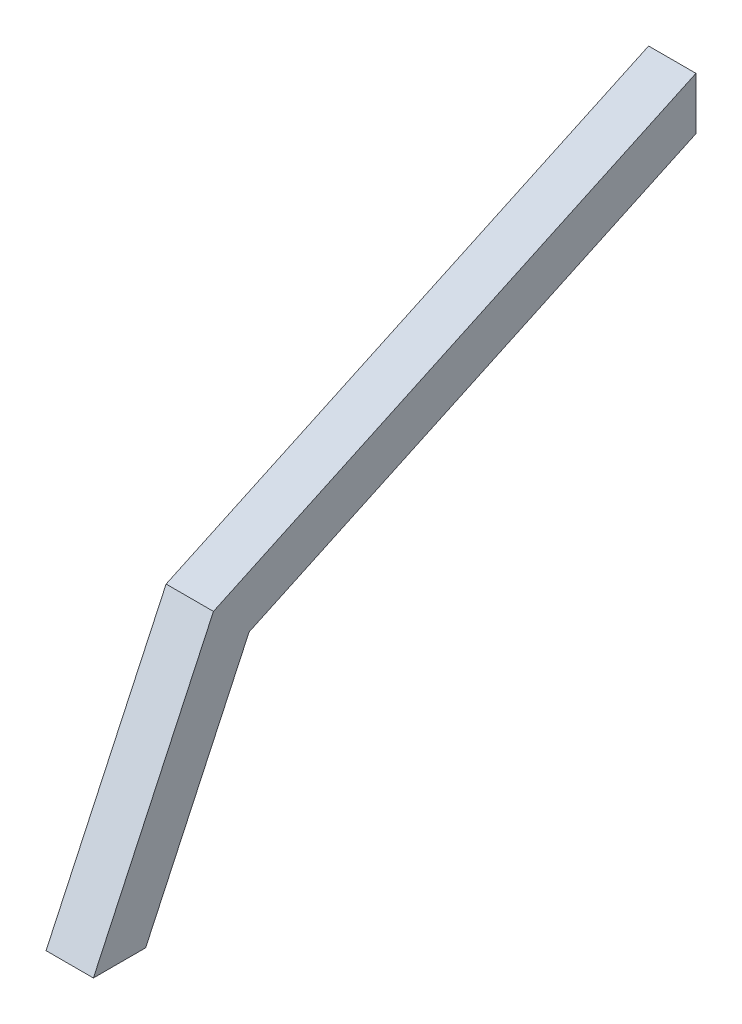
from build123d import *

# Parameters (mm, degrees)
BOSS_EXTRUDE1_DEPTH = 20
SHELL1_T            = -1.2


with BuildPart() as part:
    # Sketch2 → Boss-Extrude1 (new body)
    with BuildSketch(Plane(origin=(0, 0, 0), x_dir=(0, 0, -1), z_dir=(1, 0, 0))):
        Polygon((0, 0), (-22.067558379, 0), (28.64663303, 108.756934444), (232.463172314, 203.682917329), (232.463172314, 181.620135221), (43.694156178, 93.70242031), align=None)
    extrude(amount=BOSS_EXTRUDE1_DEPTH)

    # Shell1
    shell1_openings = [part.faces().sort_by_distance(p)[0] for p in [
        (10, 0, 11.03377919),
        (10, 192.651526275, -232.463172314),
    ]]
    offset(amount=SHELL1_T, openings=shell1_openings, kind=Kind.INTERSECTION)


solid = part.part
